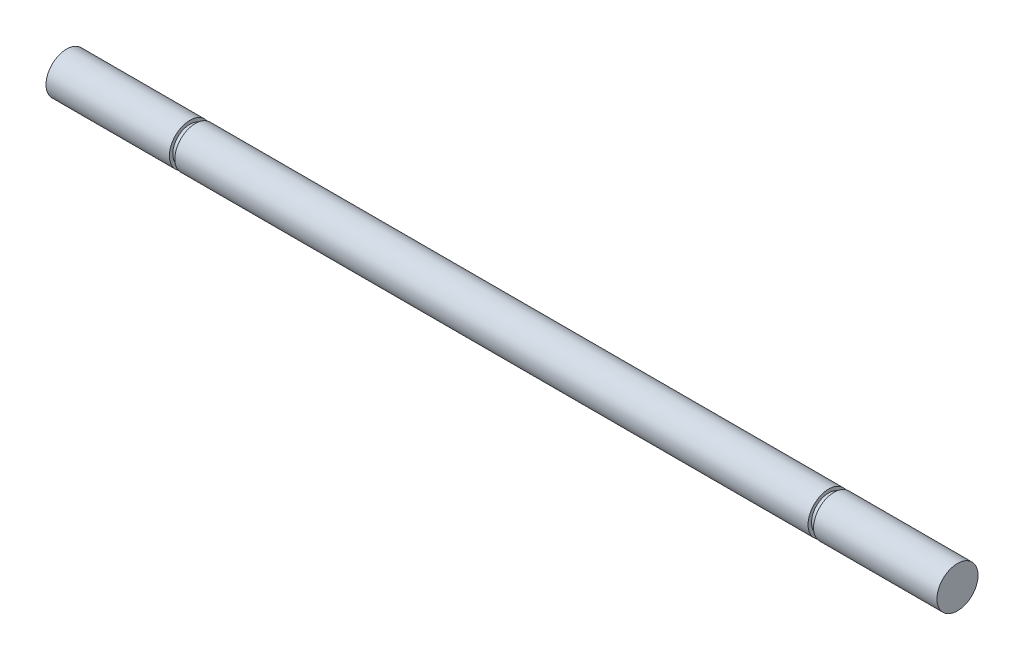
from build123d import *


with BuildPart() as part:
    # Sketch2 → Revolve1 (revolve)
    with BuildSketch(Plane.XY, mode=Mode.PRIVATE) as revolve1_sk:
        Polygon((18.8, -3), (111.2, -3), (111.2, -2.5), (112, -2.5), (112, -3), (130, -3), (130, 0), (0, 0), (0, -3), (18, -3), (18, -2.5), (18.8, -2.5), align=None)
    revolve(revolve1_sk.sketch.rotate(Axis((0, 0, 0), (1, 0, 0)), 270), axis=Axis((0, 0, 0), (1, 0, 0)))


solid = part.part
